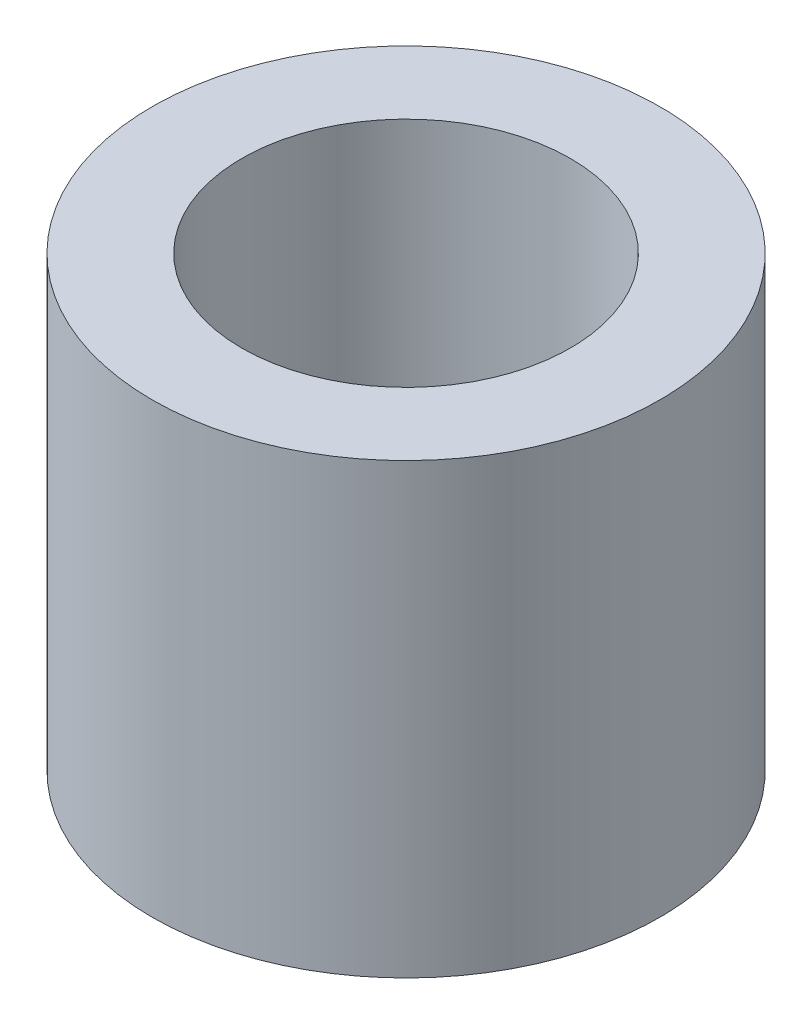
from build123d import *

# Parameters (mm, degrees)
SKETCH1_R           = 1.7
SKETCH1_R_2         = 1.1
BOSS_EXTRUDE1_DEPTH = 3


with BuildPart() as part:
    # Sketch1 → Boss-Extrude1 (new body)
    with BuildSketch(Plane(origin=(0, 0, 0), x_dir=(1, 0, 0), z_dir=(0, 1, 0))):
        with Locations(Location((0, 0, 0), (0, 0, 270))):
            Circle(SKETCH1_R)
        with Locations(Location((0, 0, 0), (0, 0, 270))):
            Circle(SKETCH1_R_2, mode=Mode.SUBTRACT)
    extrude(amount=BOSS_EXTRUDE1_DEPTH)


solid = part.part
